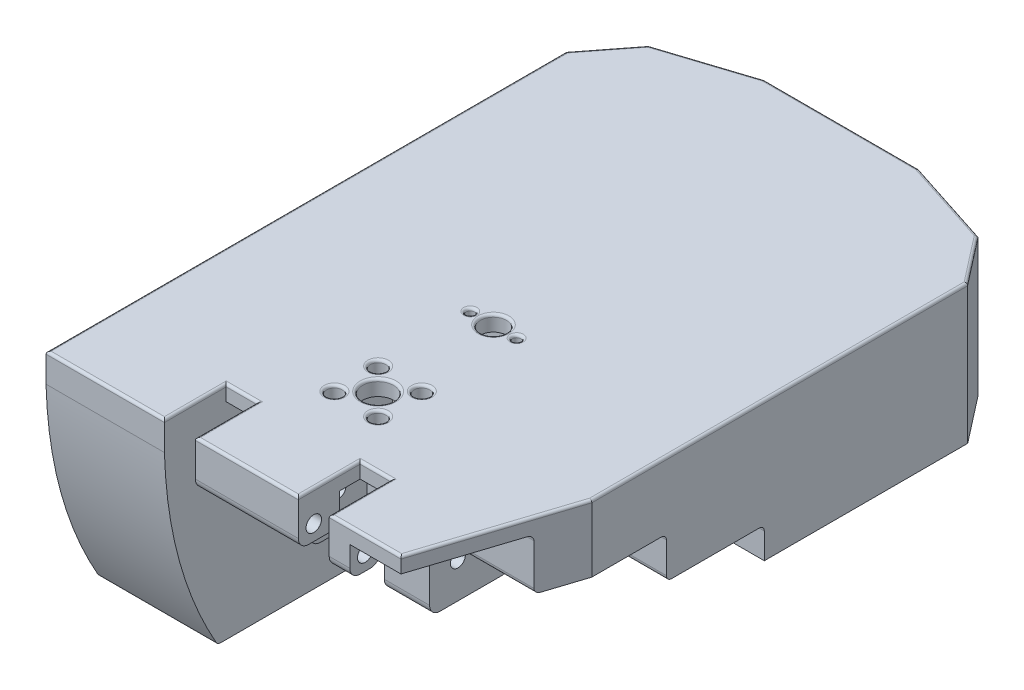
from build123d import *

# Parameters (mm, degrees)
SKETCH_1_R           = 3
EXTRUDE_1_DEPTH      = 3
SKETCH_4_W           = 4
SKETCH_4_H           = 6
SKETCH_4_W_2         = 20
SKETCH_4_H_2         = 8
EXTRUDE_3_DEPTH      = 6
SKETCH_5_R           = 1.5
CUT_EXTRUDE_2_DEPTH  = 153.042757144
FILLET_1_R           = 2
CUT_EXTRUDE_3_REACH  = 166.414
SKETCH_8_R           = 2.5
SKETCH_8_R_2         = 0.8
CUT_EXTRUDE_4_REACH  = 166.551
SKETCH_9_R           = 1.5
SKETCH_10_W          = 23
SKETCH_10_H          = 40
EXTRUDE_4_DEPTH      = 40
CUT_EXTRUDE_5_REACH  = 167.179
EXTRUDE_5_DEPTH      = 24
CUT_EXTRUDE_START    = -8.8
SKETCH_14_R          = 1.45
CUT_EXTRUDE_6_DEPTH  = 32
FILLET_2_R           = 2
EXTRUDE_6_DEPTH      = 24
SKETCH_17_W          = 19
SKETCH_17_H          = 21.5
SKETCH_17_W_2        = 23
SKETCH_17_H_2        = 19
EXTRUDE_9_DEPTH      = 18
EXTRUDE_10_DEPTH     = 10
CUT_EXTRUDE_9_DEPTH  = 17
SKETCH_24_R          = 1
EXTRUDE_18_DEPTH     = 15
SKETCH_26_R          = 1
CUT_EXTRUDE_12_DEPTH = 25
CUT_EXTRUDE_13_DEPTH = 25
CUT_EXTRUDE_14_REACH = 116.141
SKETCH_28_W          = 15
SKETCH_28_H          = 8
CUT_EXTRUDE_15_REACH = 159.864
SKETCH_29_W          = 10
SKETCH_29_H          = 15
FILLET_3_R           = 0.5
FILLET_4_R           = 1
CUT_EXTRUDE_16_REACH = 129.362
SKETCH_30_W          = 14.4
SKETCH_30_H          = 12


with BuildPart() as part:
    # 草图1 → 凸台-拉伸1 (new body)
    with BuildSketch(Plane(origin=(0, 0, 0), x_dir=(1, 0, 0), z_dir=(0, 1, 0))):
        Polygon((32, 140), (62, 140), (79, 134.5), (86, 125.5), (86, 52.5), (76.941176471, 24.5), (63, 24.5), (63, 36.5), (57, 36.5), (57, 24.5), (37, 24.5), (37, 36.5), (31, 36.5), (31, 24.5), (8, 24.5), (8, 52.5), (8, 125.5), (15, 134.5), align=None)
        with Locations(Location((47, 50, 0), (0, 0, 270))):
            Circle(SKETCH_1_R, mode=Mode.SUBTRACT)
    extrude(amount=EXTRUDE_1_DEPTH)

    # 草图4 → 凸台-拉伸3 (add)
    with BuildSketch(Plane(origin=(0, 0, 0), x_dir=(1, 0, 0), z_dir=(0, 1, 0))):
        with Locations((65, 27.5)):
            Rectangle(SKETCH_4_W, SKETCH_4_H)
        with Locations((47, 28.5)):
            Rectangle(SKETCH_4_W_2, SKETCH_4_H_2)
    extrude(amount=-EXTRUDE_3_DEPTH)

    # 草图5 → 切除-拉伸2 (cut, through all)
    with BuildSketch(Plane.ZY.offset(-67)):
        with Locations(Location((-27.5, -3, 0), (0, 0, 180))):
            Circle(SKETCH_5_R)
    extrude(amount=CUT_EXTRUDE_2_DEPTH, mode=Mode.SUBTRACT)

    # 圆角1
    fillet_1_edges = [part.edges().sort_by_distance(p)[0] for p in [
        (65, -6, -30.5),
        (65, -6, -24.5),
        (47, -6, -32.5),
        (47, -6, -24.5),
    ]]
    fillet(fillet_1_edges, radius=FILLET_1_R)

    # 草图8 → 切除-拉伸3 (cut, up to next)
    with BuildSketch(Plane.XZ, mode=Mode.PRIVATE) as cut_extrude_3_sk1:
        with Locations(Location((47, -72.4, 0), (0, 0, 270))):
            Circle(SKETCH_8_R)
    cut_extrude_3_tool1 = extrude(cut_extrude_3_sk1.sketch, amount=-CUT_EXTRUDE_3_REACH, mode=Mode.PRIVATE) & part.part
    # 草图8 → 切除-拉伸3 (cut, up to next)
    with BuildSketch(Plane.XZ, mode=Mode.PRIVATE) as cut_extrude_3_sk2:
        with Locations(Location((51.5, -72.4, 0), (0, 0, 270))):
            Circle(SKETCH_8_R_2)
    cut_extrude_3_tool2 = extrude(cut_extrude_3_sk2.sketch, amount=-CUT_EXTRUDE_3_REACH, mode=Mode.PRIVATE) & part.part
    # 草图8 → 切除-拉伸3 (cut, up to next)
    with BuildSketch(Plane.XZ, mode=Mode.PRIVATE) as cut_extrude_3_sk3:
        with Locations(Location((42.5, -72.4, 0), (0, 0, 270))):
            Circle(SKETCH_8_R_2)
    cut_extrude_3_tool3 = extrude(cut_extrude_3_sk3.sketch, amount=-CUT_EXTRUDE_3_REACH, mode=Mode.PRIVATE) & part.part
    add(cut_extrude_3_tool1.solids().sort_by_distance((47, 0, -72.4))[0], mode=Mode.SUBTRACT)
    add(cut_extrude_3_tool2.solids().sort_by_distance((51.5, 0, -72.4))[0], mode=Mode.SUBTRACT)
    add(cut_extrude_3_tool3.solids().sort_by_distance((42.5, 0, -72.4))[0], mode=Mode.SUBTRACT)

    # 草图9 → 切除-拉伸4 (cut, up to next)
    with BuildSketch(Plane(origin=(0, 3, 0), x_dir=(1, 0, 0), z_dir=(0, 1, 0)), mode=Mode.PRIVATE) as cut_extrude_4_sk1:
        with Locations(Location((42.757359313, 54.242640687, 0), (0, 0, 270))):
            Circle(SKETCH_9_R)
    cut_extrude_4_tool1 = extrude(cut_extrude_4_sk1.sketch, amount=-CUT_EXTRUDE_4_REACH, mode=Mode.PRIVATE) & part.part
    # 草图9 → 切除-拉伸4 (cut, up to next)
    with BuildSketch(Plane(origin=(0, 3, 0), x_dir=(1, 0, 0), z_dir=(0, 1, 0)), mode=Mode.PRIVATE) as cut_extrude_4_sk2:
        with Locations(Location((42.757359313, 45.757359313, 0), (0, 0, 270))):
            Circle(SKETCH_9_R)
    cut_extrude_4_tool2 = extrude(cut_extrude_4_sk2.sketch, amount=-CUT_EXTRUDE_4_REACH, mode=Mode.PRIVATE) & part.part
    # 草图9 → 切除-拉伸4 (cut, up to next)
    with BuildSketch(Plane(origin=(0, 3, 0), x_dir=(1, 0, 0), z_dir=(0, 1, 0)), mode=Mode.PRIVATE) as cut_extrude_4_sk3:
        with Locations(Location((51.242640687, 45.757359313, 0), (0, 0, 270))):
            Circle(SKETCH_9_R)
    cut_extrude_4_tool3 = extrude(cut_extrude_4_sk3.sketch, amount=-CUT_EXTRUDE_4_REACH, mode=Mode.PRIVATE) & part.part
    # 草图9 → 切除-拉伸4 (cut, up to next)
    with BuildSketch(Plane(origin=(0, 3, 0), x_dir=(1, 0, 0), z_dir=(0, 1, 0)), mode=Mode.PRIVATE) as cut_extrude_4_sk4:
        with Locations(Location((51.242640687, 54.242640687, 0), (0, 0, 270))):
            Circle(SKETCH_9_R)
    cut_extrude_4_tool4 = extrude(cut_extrude_4_sk4.sketch, amount=-CUT_EXTRUDE_4_REACH, mode=Mode.PRIVATE) & part.part
    add(cut_extrude_4_tool1.solids().sort_by_distance((42.757359, 3, -54.242641))[0], mode=Mode.SUBTRACT)
    add(cut_extrude_4_tool2.solids().sort_by_distance((42.757359, 3, -45.757359))[0], mode=Mode.SUBTRACT)
    add(cut_extrude_4_tool3.solids().sort_by_distance((51.242641, 3, -45.757359))[0], mode=Mode.SUBTRACT)
    add(cut_extrude_4_tool4.solids().sort_by_distance((51.242641, 3, -54.242641))[0], mode=Mode.SUBTRACT)

    # 草图10 → 凸台-拉伸4 (add)
    with BuildSketch(Plane.XZ):
        with Locations((19.5, -44.5)):
            Rectangle(SKETCH_10_W, SKETCH_10_H)
    extrude(amount=EXTRUDE_4_DEPTH)

    # 草图12 → 切除-拉伸5 (cut, up to next)
    with BuildSketch(Plane.ZY.offset(-8), mode=Mode.PRIVATE) as cut_extrude_5_sk1:
        with BuildLine():
            Line((-34.828780377, -40), (-24.5, -40))
            Line((-24.5, -40), (-24.5, -2.537687637))
            add(Edge.make_bspline(
                [(-24.5, -2.537687637), (-25.10601157, -23.118804094), (-34.828780377, -40)],
                knots=[0.112276638, 0.112276638, 0.112276638, 0.956814023, 0.956814023, 0.956814023], degree=2))
        make_face()
    cut_extrude_5_tool1 = extrude(cut_extrude_5_sk1.sketch, amount=-CUT_EXTRUDE_5_REACH, mode=Mode.PRIVATE) & part.part
    add(cut_extrude_5_tool1.solids().sort_by_distance((8, -30.368327, -27.549214))[0], mode=Mode.SUBTRACT)

    # 草图13 → 凸台-拉伸5 (add)
    with BuildSketch(Plane.XZ):
        Polygon((54.2, -44), (63, -44), (63, -60), (31, -60), (31, -44), (39.8, -44), (39.8, -55), (54.2, -55), align=None)
    extrude(amount=EXTRUDE_5_DEPTH)

    # 草图14 → 切除-拉伸6 (cut)
    with BuildSketch(Plane(origin=(39.8, 0, 0), x_dir=(0, 0, -1), z_dir=(1, 0, 0)).offset(CUT_EXTRUDE_START)):
        with Locations(Location((49.5, -17, 0), (0, 0, 180))):
            Circle(SKETCH_14_R)
    extrude(amount=CUT_EXTRUDE_6_DEPTH, mode=Mode.SUBTRACT)

    # 圆角2
    fillet_2_edges = [part.edges().sort_by_distance(p)[0] for p in [
        (47, -24, -60),
        (58.6, -24, -44),
        (35.4, -24, -44),
    ]]
    fillet(fillet_2_edges, radius=FILLET_2_R)

    # 草图15 → 凸台-拉伸6 (add)
    with BuildSketch(Plane.XZ):
        Polygon((8, -86), (8, -125.5), (15, -134.5), (32, -140), (62, -140), (79, -134.5), (86, -125.5), (86, -86), align=None)
    extrude(amount=EXTRUDE_6_DEPTH)

    # 草图17 → 凸台-拉伸9 (add)
    with BuildSketch(Plane.XZ):
        with Locations((17.5, -75.25)):
            Rectangle(SKETCH_17_W, SKETCH_17_H)
        with Locations((74.5, -76.5)):
            Rectangle(SKETCH_17_W_2, SKETCH_17_H_2)
    extrude(amount=EXTRUDE_9_DEPTH)

    # 草图18 → 凸台-拉伸10 (add)
    with BuildSketch(Plane.XZ):
        Polygon((63, -67), (86, -67), (86, -52.5), (83.25, -44), (63, -44), align=None)
    extrude(amount=EXTRUDE_10_DEPTH)

    # 草图19 → 切除-拉伸9 (cut)
    with BuildSketch(Plane.ZY.offset(-8)):
        with BuildLine():
            Line((-88, -16), (-88, 1))
            Line((-88, 1), (-26.5, 1))
            Line((-26.5, 1), (-26.5, -2.508087081))
            add(Edge.make_bspline(
                [(-35.994977349, -38), (-32.966830723, -32.5523246), (-30.680892448, -26.849199055), (-28.714282489, -19.413695897), (-28.365493294, -17.911268154), (-27.756030959, -14.876085257), (-27.494923828, -13.339722754), (-26.846498029, -8.718318548), (-26.592665927, -5.620724839), (-26.5, -2.508087081)],
                knots=[0, 0, 0, 0, 0.5, 0.5, 0.625, 0.625, 0.75, 0.75, 1, 1, 1, 1], degree=3))
            Line((-35.994977349, -38), (-62.5, -38))
            Line((-62.5, -38), (-62.5, -16))
            Line((-62.5, -16), (-88, -16))
        make_face()
    extrude(amount=-CUT_EXTRUDE_9_DEPTH, mode=Mode.SUBTRACT)

    # 草图24 → 凸台-拉伸18 (add)
    # profile 1 of 5: a face of its own
    with BuildSketch(Plane.ZY.offset(-25)):
        with BuildLine():
            Line((-88, 1), (-88, -3.5))
            Line((-88, -3.5), (-86, -3.5))
            ThreePointArc((-86, -3.5), (-84.232233047, -2.767766953), (-83.5, -1))
            Line((-83.5, -1), (-83.5, 1))
            Line((-83.5, 1), (-88, 1))
        make_face()
        with Locations(Location((-86, -1, 0), (0, 0, 180))):
            Circle(SKETCH_24_R, mode=Mode.SUBTRACT)
    # profile 2 of 5: a face of its own
    with BuildSketch(Plane.ZY.offset(-25)):
        with BuildLine():
            Line((-86, -11.5), (-88, -11.5))
            Line((-88, -11.5), (-88, -16))
            Line((-88, -16), (-83.5, -16))
            Line((-83.5, -16), (-83.5, -14))
            ThreePointArc((-83.5, -14), (-84.232233047, -12.232233047), (-86, -11.5))
        make_face()
        with Locations(Location((-86, -14, 0), (0, 0, 180))):
            Circle(SKETCH_24_R, mode=Mode.SUBTRACT)
    # profile 3 of 5: a face of its own
    with BuildSketch(Plane.ZY.offset(-25)):
        with BuildLine():
            Line((-26.5, 1), (-30.008087081, 1))
            Line((-30.008087081, 1), (-30.008087081, -0.508087081))
            ThreePointArc((-30.008087081, -0.508087081), (-29.422300643, -1.922300643), (-28.008087081, -2.508087081))
            Line((-28.008087081, -2.508087081), (-26.5, -2.508087081))
            Line((-26.5, -2.508087081), (-26.5, 1))
        make_face()
        with Locations(Location((-28.008087081, -0.508087081, 0), (0, 0, 180))):
            Circle(SKETCH_24_R, mode=Mode.SUBTRACT)
    # profile 4 of 5: a face of its own
    with BuildSketch(Plane.ZY.offset(-25)):
        with BuildLine():
            Line((-60.5, -33.5), (-62.5, -33.5))
            Line((-62.5, -33.5), (-62.5, -38))
            Line((-62.5, -38), (-58, -38))
            Line((-58, -38), (-58, -36))
            ThreePointArc((-58, -36), (-58.732233047, -34.232233047), (-60.5, -33.5))
        make_face()
        with Locations(Location((-60.5, -36, 0), (0, 0, 180))):
            Circle(SKETCH_24_R, mode=Mode.SUBTRACT)
    # profile 5 of 5: a face of its own
    with BuildSketch(Plane.ZY.offset(-25)):
        with BuildLine():
            add(Edge.make_bspline(
                [(-35.994977349, -38), (-35.171646024, -36.518816172), (-34.403182974, -35.018748013), (-33.688994087, -33.5)],
                knots=[0, 0, 0, 0, 0.13594641, 0.13594641, 0.13594641, 0.13594641], degree=3))
            Line((-33.688994087, -33.5), (-36.994977349, -33.5))
            ThreePointArc((-36.994977349, -33.5), (-38.762744302, -34.232233047), (-39.494977349, -36))
            Line((-39.494977349, -36), (-39.494977349, -38))
            Line((-39.494977349, -38), (-35.994977349, -38))
        make_face()
        with Locations(Location((-36.994977349, -36, 0), (0, 0, 180))):
            Circle(SKETCH_24_R, mode=Mode.SUBTRACT)
    extrude(amount=EXTRUDE_18_DEPTH)

    # 草图26 → 切除-拉伸12 (cut)
    with BuildSketch(Plane.XZ.offset(24)):
        with Locations(Location((84, -90, 0), (0, 0, 270))):
            Circle(SKETCH_26_R)
        with Locations(Location((62, -137, 0), (0, 0, 270))):
            Circle(SKETCH_26_R)
        with Locations(Location((32, -137, 0), (0, 0, 270))):
            Circle(SKETCH_26_R)
        with Locations(Location((10, -90, 0), (0, 0, 270))):
            Circle(SKETCH_26_R)
    extrude(amount=-CUT_EXTRUDE_12_DEPTH, mode=Mode.SUBTRACT)

    # 草图27 → 切除-拉伸13 (cut)
    with BuildSketch(Plane.XZ.offset(24)):
        with BuildLine():
            Line((81.5, -90), (12.5, -90))
            ThreePointArc((12.5, -90), (11.756868901, -91.778598231), (9.969270667, -92.499811134))
            Line((9.969270667, -92.499811134), (9.578704435, -124.272118773))
            Line((9.578704435, -124.272118773), (16.200992901, -132.786489658))
            Line((16.200992901, -132.786489658), (29.501607209, -137.089629581))
            ThreePointArc((29.501607209, -137.089629581), (32.466815477, -134.54397001), (34.291287847, -138))
            Line((34.291287847, -138), (59.708712153, -138))
            ThreePointArc((59.708712153, -138), (61.533184523, -134.54397001), (64.498392791, -137.089629581))
            Line((64.498392791, -137.089629581), (77.799007099, -132.786489658))
            Line((77.799007099, -132.786489658), (84.421295565, -124.272118773))
            Line((84.421295565, -124.272118773), (84.030729333, -92.499811134))
            ThreePointArc((84.030729333, -92.499811134), (82.243131099, -91.778598231), (81.5, -90))
        make_face()
    extrude(amount=-CUT_EXTRUDE_13_DEPTH, mode=Mode.SUBTRACT)

    # 草图28 → 切除-拉伸14 (cut, up to next)
    with BuildSketch(Plane.XY.offset(-88), mode=Mode.PRIVATE) as cut_extrude_14_sk1:
        with Locations((17.5, -7.5)):
            Rectangle(SKETCH_28_W, SKETCH_28_H)
    cut_extrude_14_tool1 = extrude(cut_extrude_14_sk1.sketch, amount=-CUT_EXTRUDE_14_REACH, mode=Mode.PRIVATE) & part.part
    add(cut_extrude_14_tool1.solids().sort_by_distance((17.5, -7.5, -88))[0], mode=Mode.SUBTRACT)

    # 草图29 → 切除-拉伸15 (cut, up to next)
    with BuildSketch(Plane.ZY.offset(-25), mode=Mode.PRIVATE) as cut_extrude_15_sk1:
        with Locations((-78.5, -8.5)):
            Rectangle(SKETCH_29_W, SKETCH_29_H)
    cut_extrude_15_tool1 = extrude(cut_extrude_15_sk1.sketch, amount=-CUT_EXTRUDE_15_REACH, mode=Mode.PRIVATE) & part.part
    add(cut_extrude_15_tool1.solids().sort_by_distance((25, -8.5, -78.5))[0], mode=Mode.SUBTRACT)

    # 圆角3
    fillet_3_edges = [part.edges().sort_by_distance(p)[0] for p in [
        (23.5, 3, -137.25),
        (47, 3, -69.9),
        (51.5, 3, -71.6),
        (42.5, 3, -71.6),
        (11.5, 3, -130),
        (42.757359313, 3, -47.257359313),
        (51.242640687, 3, -47.257359313),
        (42.757359313, 3, -55.742640687),
        (51.242640687, 3, -55.742640687),
        (8, 3, -75),
        (19.5, 3, -24.5),
        (31, 3, -30.5),
        (34, 3, -36.5),
        (37, 3, -30.5),
        (47, 3, -24.5),
        (57, 3, -30.5),
        (70.5, 3, -137.25),
        (60, 3, -36.5),
        (63, 3, -30.5),
        (47, 3, -53),
        (69.970588235, 3, -24.5),
        (81.470588235, 3, -38.5),
        (86, 3, -89),
        (82.5, 3, -130),
        (47, 3, -140),
    ]]
    fillet(fillet_3_edges, radius=FILLET_3_R)

    # 圆角4
    fillet_4_edges = [part.edges().sort_by_distance(p)[0] for p in [
        (74.5, -18, -67),
        (74.5, -10, -67),
        (74.5, -18, -86),
        (17.5, -18, -86),
        (17.5, -18, -64.5),
        (73.125, -10, -44),
        (68.725, 0, -44),
        (19.5, -40, -64.5),
        (19.5, -40, -34.828780377),
    ]]
    fillet(fillet_4_edges, radius=FILLET_4_R)

    # 草图30 → 切除-拉伸16 (cut, up to next)
    with BuildSketch(Plane.XY.offset(-55), mode=Mode.PRIVATE) as cut_extrude_16_sk1:
        with Locations((47, -6)):
            Rectangle(SKETCH_30_W, SKETCH_30_H)
    cut_extrude_16_tool1 = extrude(cut_extrude_16_sk1.sketch, amount=-CUT_EXTRUDE_16_REACH, mode=Mode.PRIVATE) & part.part
    add(cut_extrude_16_tool1.solids().sort_by_distance((47, -6, -55))[0], mode=Mode.SUBTRACT)


solid = part.part
